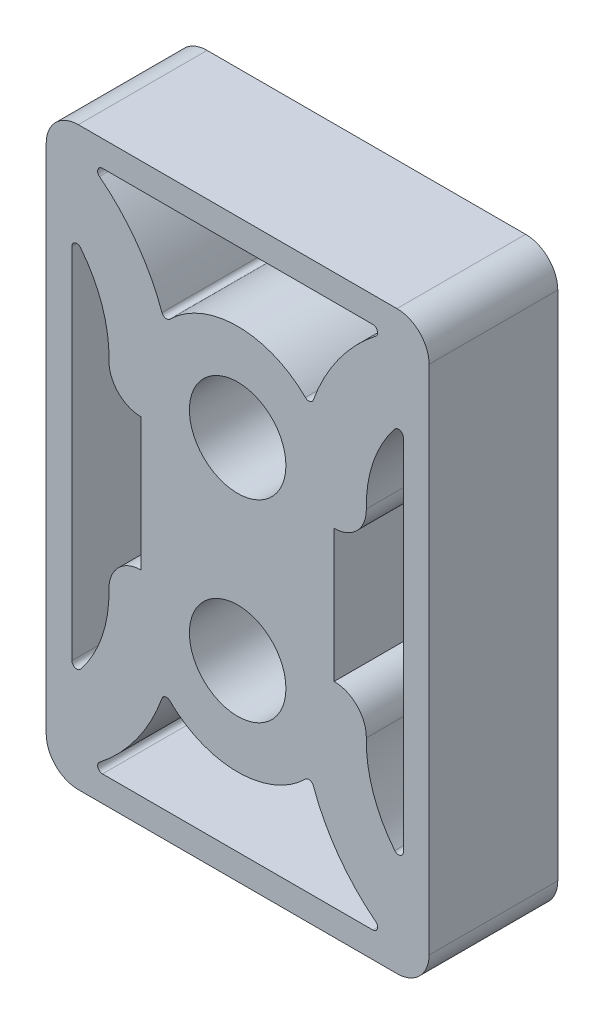
from build123d import *

# Parameters (mm, degrees)
SKETCH1_R           = 1.5
BOSS_EXTRUDE1_DEPTH = 4
SKETCH3_W           = 11.9
SKETCH3_H           = 17.9
BOSS_EXTRUDE2_DEPTH = 4
FILLET1_R           = 1
FILLET2_R           = 0.15


with BuildPart() as part:
    # Sketch1 → Boss-Extrude1 (new body)
    with BuildSketch(Plane.XY):
        with BuildLine():
            Line((3, 3), (3, -3))
            ThreePointArc((3, -3), (0, -6), (-3, -3))
            Line((-3, -3), (-3, 3))
            ThreePointArc((-3, 3), (0, 6), (3, 3))
        make_face()
        with Locations((0, 3)):
            Circle(SKETCH1_R, mode=Mode.SUBTRACT)
        with Locations((0, -3)):
            Circle(SKETCH1_R, mode=Mode.SUBTRACT)
    extrude(amount=BOSS_EXTRUDE1_DEPTH)

    # Sketch3 → Boss-Extrude2 (add)
    with BuildSketch(Plane.XY):
        Rectangle(SKETCH3_W, SKETCH3_H)
        with BuildLine():
            Line((3, 2.060806436), (3, 3))
            ThreePointArc((3, 3), (2.812460431, 4.044062414), (2.273289117, 4.957589484))
            ThreePointArc((2.273289117, 4.957589484), (3.195390382, 6.758191712), (4.663487388, 8.15))
            Line((4.663487388, 8.15), (-4.663487388, 8.15))
            ThreePointArc((-4.663487388, 8.15), (-3.195390382, 6.758191712), (-2.273289117, 4.957589484))
            ThreePointArc((-2.273289117, 4.957589484), (-2.812460431, 4.044062414), (-3, 3))
            Line((-3, 3), (-3, 2.060806436))
            ThreePointArc((-3, 2.060806436), (-3.713836261, 2.361122359), (-3.999178271, 3.081074995))
            ThreePointArc((-3.999178271, 3.081074995), (-4.282258248, 4.642222106), (-5.15, 5.970506272))
            Line((-5.15, 5.970506272), (-5.15, -5.970506272))
            ThreePointArc((-5.15, -5.970506272), (-4.282258248, -4.642222106), (-3.999178271, -3.081074995))
            ThreePointArc((-3.999178271, -3.081074995), (-3.713836261, -2.361122359), (-3, -2.060806436))
            Line((-3, -2.060806436), (-3, -3))
            ThreePointArc((-3, -3), (-2.812460431, -4.044062414), (-2.273289117, -4.957589484))
            ThreePointArc((-2.273289117, -4.957589484), (-3.195390382, -6.758191712), (-4.663487388, -8.15))
            Line((-4.663487388, -8.15), (4.663487388, -8.15))
            ThreePointArc((4.663487388, -8.15), (3.195390382, -6.758191712), (2.273289117, -4.957589484))
            ThreePointArc((2.273289117, -4.957589484), (2.812460431, -4.044062414), (3, -3))
            Line((3, -3), (3, -2.060806436))
            ThreePointArc((3, -2.060806436), (3.713836261, -2.361122359), (3.999178271, -3.081074995))
            ThreePointArc((3.999178271, -3.081074995), (4.282258248, -4.642222106), (5.15, -5.970506272))
            Line((5.15, -5.970506272), (5.15, 5.970506272))
            ThreePointArc((5.15, 5.970506272), (4.282258248, 4.642222106), (3.999178271, 3.081074995))
            ThreePointArc((3.999178271, 3.081074995), (3.713836261, 2.361122359), (3, 2.060806436))
        make_face(mode=Mode.SUBTRACT)
    extrude(amount=BOSS_EXTRUDE2_DEPTH)

    # Fillet1
    fillet1_edges = [part.edges().sort_by_distance(p)[0] for p in [
        (5.95, 8.95, 2),
        (-5.95, 8.95, 2),
        (-5.95, -8.95, 2),
        (5.95, -8.95, 2),
    ]]
    fillet(fillet1_edges, radius=FILLET1_R)

    # Fillet2
    fillet2_edges = [part.edges().sort_by_distance(p)[0] for p in [
        (-5.15, 5.970506272, 2),
        (-5.15, -5.970506272, 2),
        (-2.273289117, -4.957589484, 2),
        (-4.663487388, -8.15, 2),
        (4.663487388, -8.15, 2),
        (2.273289117, -4.957589484, 2),
        (5.15, -5.970506272, 2),
        (5.15, 5.970506272, 2),
        (2.273289117, 4.957589484, 2),
        (4.663487388, 8.15, 2),
        (-4.663487388, 8.15, 2),
        (-2.273289117, 4.957589484, 2),
    ]]
    fillet(fillet2_edges, radius=FILLET2_R)


solid = part.part
